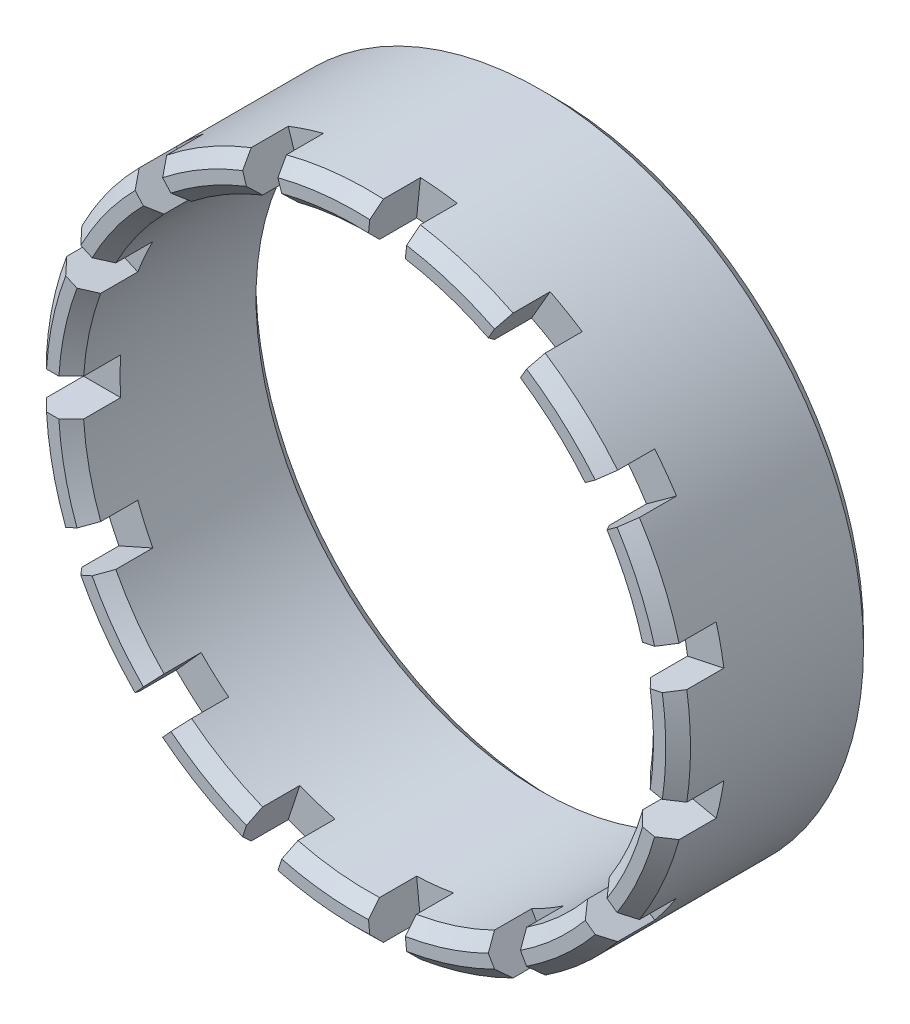
from build123d import *

# Parameters (mm, degrees)
SKETCH1_R           = 41.402
SKETCH1_R_2         = 36.6395
BOSS_EXTRUDE1_DEPTH = 25.4
CHAMFER1_SIZE       = 1.5875
SKETCH2_W           = 12.7
SKETCH2_H           = 4.7625
CUT_EXTRUDE1_DEPTH  = 64.823281081
CIRPATTERN1_COUNT   = 15


with BuildPart() as part:
    # Sketch1 → Boss-Extrude1 (new body)
    with BuildSketch(Plane.XY):
        Circle(SKETCH1_R)
        Circle(SKETCH1_R_2, mode=Mode.SUBTRACT)
    extrude(amount=-BOSS_EXTRUDE1_DEPTH)

    # Chamfer1
    chamfer1_edges = [part.edges().sort_by_distance(p)[0] for p in [
        (-41.402, 0, 0),
        (-41.402, 0, -25.4),
        (-36.6395, 0, -25.4),
        (-36.6395, 0, 0),
    ]]
    chamfer(chamfer1_edges, length=CHAMFER1_SIZE)

    # Sketch2 → Cut-Extrude1 (cut, through all)
    with BuildSketch(Plane(origin=(0, 0, 0), x_dir=(0, 0, -1), z_dir=(1, 0, 0))):
        Rectangle(SKETCH2_W, SKETCH2_H)
    cut_extrude1 = extrude(amount=-CUT_EXTRUDE1_DEPTH, mode=Mode.SUBTRACT)

    # CirPattern1: Cut-Extrude1 ×15 about axis
    cirpattern1_axis = Axis((0, 0, 0), (0, 0, 1))
    for i in range(1, CIRPATTERN1_COUNT):
        add(cut_extrude1.rotate(cirpattern1_axis, i * 360 / CIRPATTERN1_COUNT), mode=Mode.SUBTRACT)


solid = part.part
